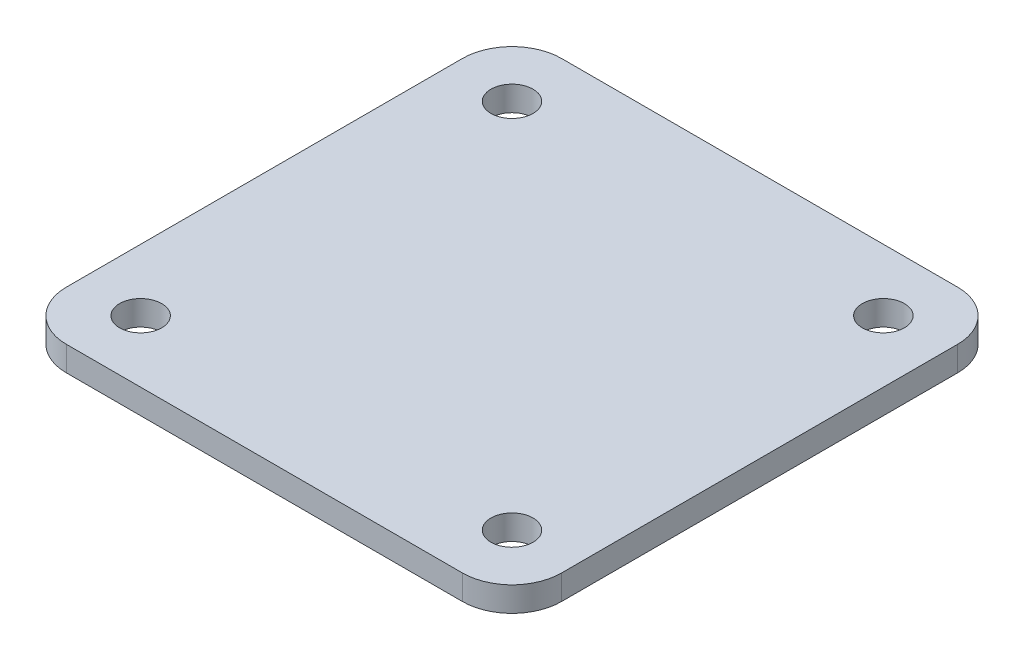
from build123d import *

# Parameters (mm, degrees)
SKETCH1_W           = 40
SKETCH1_H           = 40
SKETCH1_R           = 1.7
BOSS_EXTRUDE1_DEPTH = 2
FILLET1_R           = 4


with BuildPart() as part:
    # Sketch1 → Boss-Extrude1 (new body)
    with BuildSketch(Plane(origin=(0, 0, 0), x_dir=(1, 0, 0), z_dir=(0, 1, 0))):
        Rectangle(SKETCH1_W, SKETCH1_H)
        with Locations(Location((15, 15, 0), (0, 0, 270))):
            Circle(SKETCH1_R, mode=Mode.SUBTRACT)
        with Locations(Location((-15, 15, 0), (0, 0, 270))):
            Circle(SKETCH1_R, mode=Mode.SUBTRACT)
        with Locations(Location((-15, -15, 0), (0, 0, 270))):
            Circle(SKETCH1_R, mode=Mode.SUBTRACT)
        with Locations(Location((15, -15, 0), (0, 0, 270))):
            Circle(SKETCH1_R, mode=Mode.SUBTRACT)
    extrude(amount=BOSS_EXTRUDE1_DEPTH)

    # Fillet1
    fillet1_edges = [part.edges().sort_by_distance(p)[0] for p in [
        (20, 1, 20),
        (-20, 1, 20),
        (-20, 1, -20),
        (20, 1, -20),
    ]]
    fillet(fillet1_edges, radius=FILLET1_R)


solid = part.part
